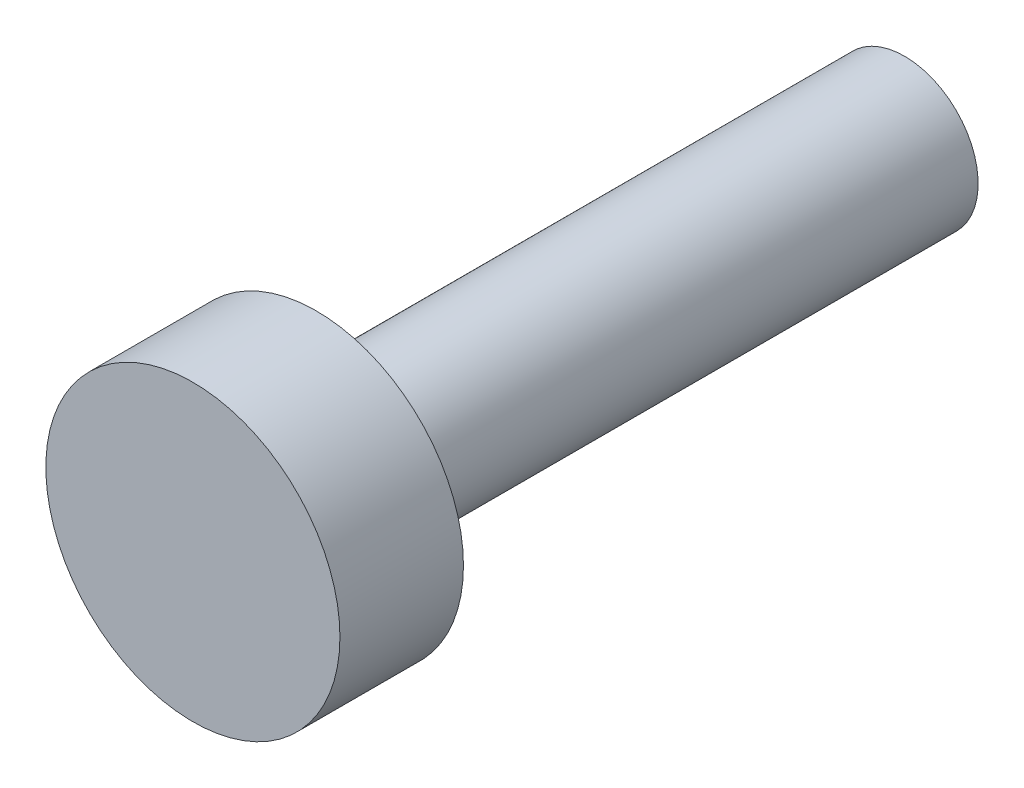
from build123d import *

# Parameters (mm, degrees)
ESQUISSE1_R        = 2.5
BOSS_EXTRU_1_DEPTH = 2.1
ESQUISSE2_R        = 1.25
BOSS_EXTRU_2_DEPTH = 10


with BuildPart() as part:
    # Esquisse1 → Boss.-Extru.1 (new body)
    with BuildSketch(Plane.XY):
        Circle(ESQUISSE1_R)
    extrude(amount=BOSS_EXTRU_1_DEPTH)

    # Esquisse2 → Boss.-Extru.2 (add)
    with BuildSketch(Plane(origin=(0, 0, 0), x_dir=(-1, 0, 0), z_dir=(0, 0, -1))):
        Circle(ESQUISSE2_R)
    extrude(amount=BOSS_EXTRU_2_DEPTH)


solid = part.part
